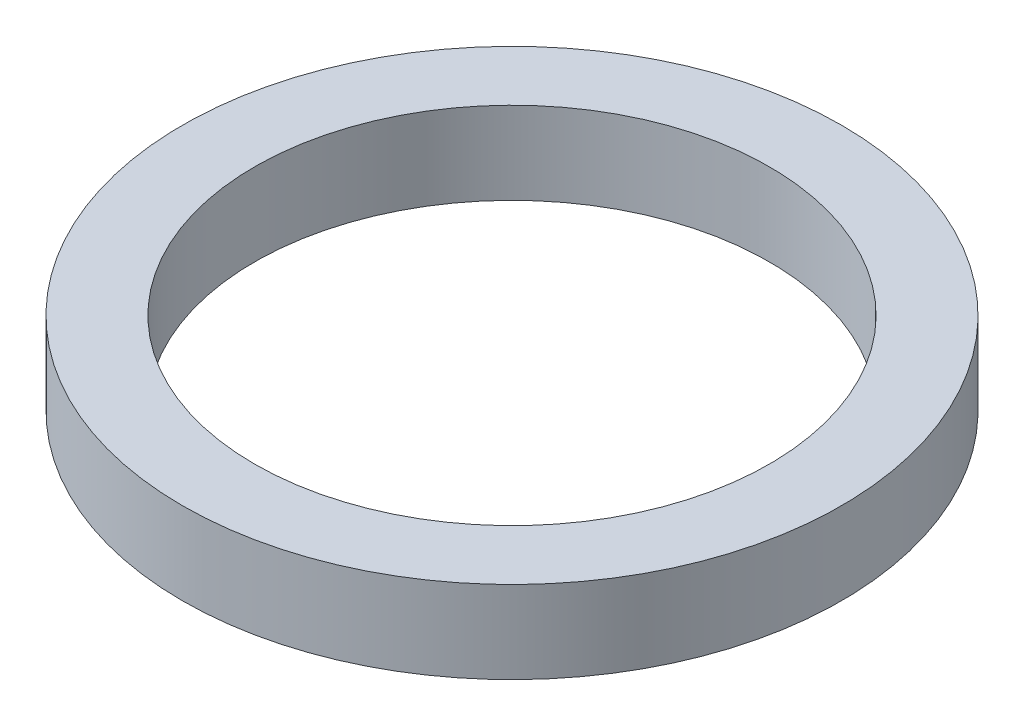
from build123d import *

# Parameters (mm, degrees)
SKETCH1_R           = 16
SKETCH1_R_2         = 12.5
BOSS_EXTRUDE1_DEPTH = 4


with BuildPart() as part:
    # Sketch1 → Boss-Extrude1 (new body)
    with BuildSketch(Plane(origin=(0, 0, 0), x_dir=(1, 0, 0), z_dir=(0, 1, 0))):
        with Locations(Location((0, 0, 0), (0, 0, 270))):
            Circle(SKETCH1_R)
        with Locations(Location((0, 0, 0), (0, 0, 270))):
            Circle(SKETCH1_R_2, mode=Mode.SUBTRACT)
    extrude(amount=BOSS_EXTRUDE1_DEPTH)


solid = part.part
